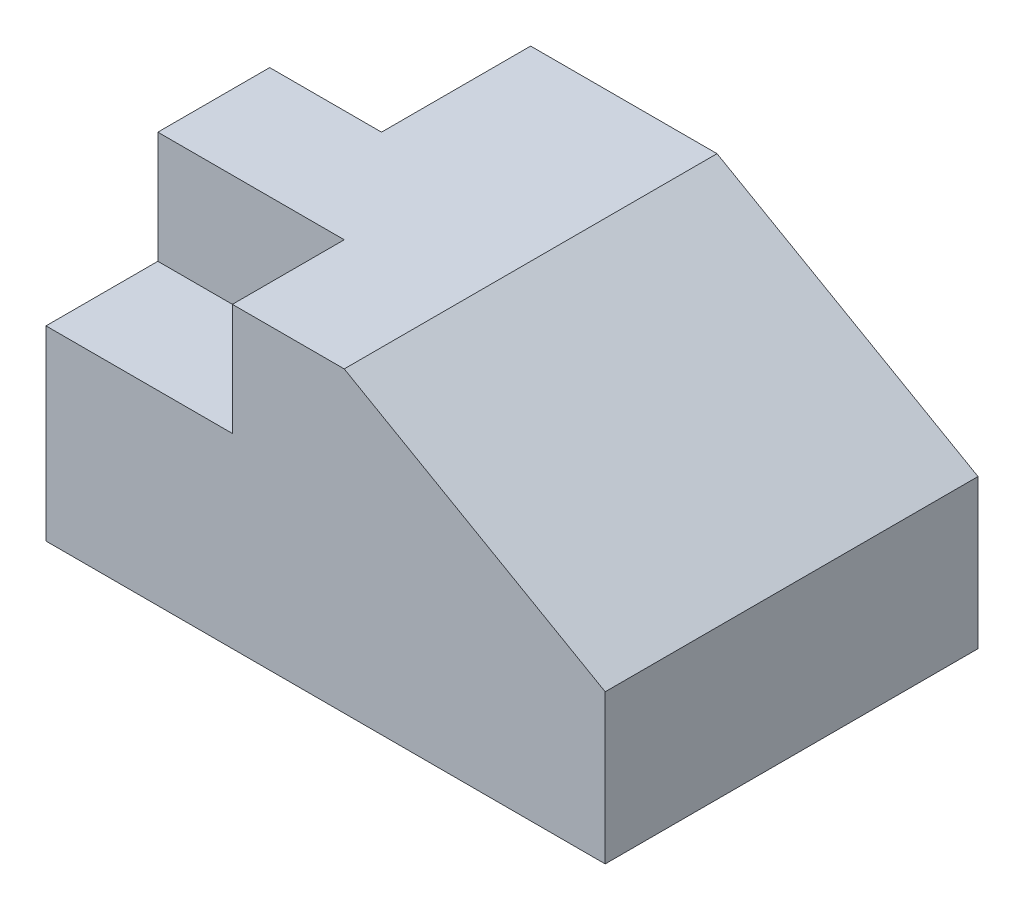
from build123d import *

# Parameters (mm, degrees)
BOSS_EXTRUDE1_DEPTH = 100
SKETCH2_W           = 50
SKETCH2_H           = 30
CUT_EXTRUDE1_DEPTH  = 30
SKETCH3_W           = 30
SKETCH3_H           = 40
CUT_EXTRUDE2_DEPTH  = 198.230829233


with BuildPart() as part:
    # Sketch1 → Boss-Extrude1 (new body)
    with BuildSketch(Plane.XY):
        Polygon((0, 0), (150, 0), (150, 40), (80, 80), (0, 80), align=None)
    extrude(amount=-BOSS_EXTRUDE1_DEPTH)

    # Sketch2 → Cut-Extrude1 (cut)
    with BuildSketch(Plane.XY):
        with Locations((25, 65)):
            Rectangle(SKETCH2_W, SKETCH2_H)
    extrude(amount=-CUT_EXTRUDE1_DEPTH, mode=Mode.SUBTRACT)

    # Sketch3 → Cut-Extrude2 (cut, through all)
    with BuildSketch(Plane(origin=(0, 80, 0), x_dir=(1, 0, 0), z_dir=(0, 1, 0))):
        with Locations((15, 80)):
            Rectangle(SKETCH3_W, SKETCH3_H)
    extrude(amount=-CUT_EXTRUDE2_DEPTH, mode=Mode.SUBTRACT)


solid = part.part
